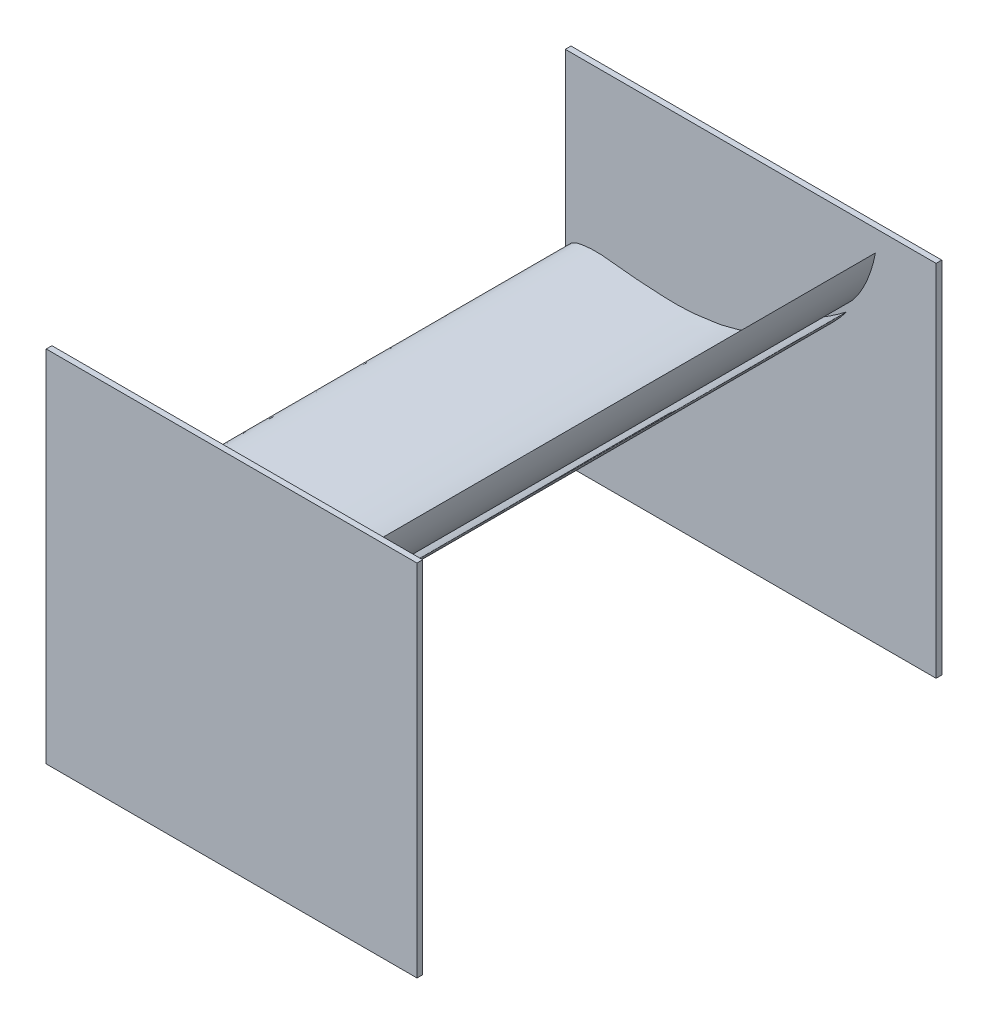
from build123d import *

# Parameters (mm, degrees)
BOSS_EXTRUDE1_DEPTH   = 900
BOSS_EXTRUDE1_2_DEPTH = 900
BOSS_EXTRUDE1_3_DEPTH = 900
SKETCH3_W             = 650
SKETCH3_H             = 630
BOSS_EXTRUDE2_DEPTH   = 10
SKETCH5_W             = 650
SKETCH5_H             = 630
BOSS_EXTRUDE3_DEPTH   = 10


with BuildPart() as part:
    # Sketch2 → Boss-Extrude1 (new body)
    with BuildSketch(Plane.XY):
        with BuildLine():
            add(Edge.make_bspline(
                [(0, 0), (-0.65975565, -5.699703464), (8.017548516, -15.480562025), (19.551157506, -21.724015646), (30.016745353, -25.302215165), (39.859962541, -28.8642232), (50.040399275, -30.662933418), (60.070603806, -32.257702331), (70.013877162, -34.217674322), (80.100972933, -34.55999195), (90.093066457, -35.36519438), (100.111969814, -35.952943269), (110.128217778, -35.507216678), (120.153157744, -35.210003546), (130.150331683, -34.229800116), (140.189993261, -33.410162922), (150.178235204, -31.913406007), (160.170449627, -30.371338734), (170.240789754, -29.163640841), (180.208316099, -27.151030087), (190.263801281, -25.306120223), (200.239152099, -22.872450662), (210.244577583, -20.429111012), (220.232934245, -17.895088966), (230.381125348, -15.705438437), (240.351948949, -12.391144832), (253.551193017, -7.369638816), (266.947574476, -2.806549313), (280.436865809, 1.636643436), (290.361357742, 5.819516769), (300.440735094, 10.032227759), (310.304777653, 14.884053202), (323.821431636, 20.884190166), (337.30228202, 27.249833417), (350.274680503, 34.850235797), (364.037447664, 41.200679435), (378.073354269, 50.431878374), (389.268655411, 56.991671546), (404.933124868, 70.670428585), (388.893146181, 60.897261379), (380.961681237, 56.833339948), (370.316551331, 52.173205743), (360.413556578, 47.749137904), (350.469658047, 43.075442492), (340.496714174, 38.833200032), (330.405194537, 35.260956145), (320.349773519, 31.849438488), (310.358327921, 28.32591748), (300.486931551, 24.662169398), (290.321799777, 22.300639283), (280.290360105, 19.76188557), (270.426731207, 16.765017679), (260.335958512, 15.061341224), (250.276874186, 13.958758108), (240.266180313, 12.578254982), (230.278688892, 11.06786106), (220.28670052, 9.696364143), (210.243264635, 9.240413966), (200.228739037, 9.034505305), (190.217040672, 8.279165066), (180.212460889, 9.162360851), (170.184221628, 8.728504773), (160.186505008, 9.582197967), (150.167787888, 9.989196896), (140.163470123, 10.700746944), (130.145958281, 11.214450998), (120.121382338, 11.840881885), (110.132801048, 12.969737489), (100.114836916, 13.850136605), (90.093770057, 14.715857774), (80.079633724, 15.842660607), (56.917746978, 18.847498868), (32.382831952, 18.963380484), (8.41761673, 12.262874152), (0.546057517, 4.717452477), (0, 0)],
                knots=[0, 0, 0, 0, 0.022023736, 0.035622153, 0.048196888, 0.060584536, 0.072602109, 0.084545422, 0.096478612, 0.108283816, 0.120089627, 0.131879307, 0.143660654, 0.15544949, 0.167268546, 0.17910001, 0.190991158, 0.20289685, 0.214787999, 0.226765538, 0.23876847, 0.250863752, 0.262991876, 0.27512, 0.287234564, 0.299600692, 0.31214973, 0.337081787, 0.34954249, 0.362249466, 0.375072168, 0.388091419, 0.401030286, 0.427260863, 0.440708926, 0.453891579, 0.481343844, 0.495528159, 0.510184265, 0.522427916, 0.535732546, 0.548643086, 0.561553626, 0.574510663, 0.587286643, 0.599816472, 0.612271303, 0.624763182, 0.637218013, 0.649381244, 0.661544475, 0.673750263, 0.685718325, 0.697586388, 0.709471547, 0.721375261, 0.733243324, 0.745039761, 0.756824219, 0.768610895, 0.780397571, 0.792175284, 0.803971722, 0.815766061, 0.82756692, 0.839363385, 0.851169099, 0.863005976, 0.874833225, 0.886659586, 0.898509641, 0.910371212, 0.969295412, 0.981771696, 1, 1, 1, 1], degree=3))
        make_face()
    extrude(amount=BOSS_EXTRUDE1_DEPTH)



with BuildPart() as body_2:
    # Sketch2 → Boss-Extrude1 2 (new body)
    with BuildSketch(Plane.XY):
        with BuildLine():
            add(Edge.make_bspline(
                [(488.73992863, 146.276625829), (488.734390863, 146.282664356), (488.424255517, 146.015046997), (488.06224571, 145.78510435), (487.262468982, 145.126312202), (486.219708703, 144.371292999), (484.873478649, 143.336701677), (483.250678892, 142.116067573), (481.344943871, 140.702556836), (479.183854282, 139.108333078), (476.761259361, 137.364331889), (474.123745832, 135.449437464), (471.236790602, 133.439330858), (468.165688429, 131.291310186), (464.896239769, 129.067635846), (461.457519682, 126.769533617), (457.874048726, 124.410588123), (454.151349507, 122.026984888), (450.329646269, 119.608278587), (446.41836705, 117.19210493), (442.442349173, 114.792641259), (438.43193703, 112.415341988), (434.42114363, 110.058907294), (430.419325782, 107.74839744), (426.469079038, 105.475179612), (422.572434597, 103.270040027), (418.782946314, 101.105445668), (415.103822048, 99.01892845), (411.581105321, 96.980001912), (408.223119368, 95.024650916), (405.070149132, 93.117181313), (402.117764879, 91.312769814), (399.415735867, 89.554324386), (396.965291652, 87.893504979), (394.792388291, 86.318571947), (392.915837215, 84.829964237), (391.349809227, 83.430905822), (390.083467317, 82.150893966), (389.152598068, 80.964624913), (388.566460536, 79.872034746), (388.31048608, 78.86894122), (388.452520239, 77.947544055), (389.013376817, 77.204475769), (389.915554573, 76.684991476), (391.128157446, 76.384212118), (392.650081725, 76.254634507), (394.48507873, 76.313765499), (396.623198675, 76.579439281), (399.045948072, 77.035742523), (401.735792151, 77.720460618), (404.675674285, 78.596752435), (407.839178956, 79.704940552), (411.200777121, 81.026852514), (414.720896472, 82.590974299), (418.395557374, 84.341793332), (422.179917585, 86.309143039), (426.045683707, 88.480043342), (429.970357242, 90.828820323), (433.914957703, 93.364526939), (437.871228384, 96.040204149), (441.793376071, 98.866131635), (445.668479549, 101.797178284), (449.465692449, 104.827226536), (453.167907327, 107.924049831), (456.76145535, 111.053999458), (460.202936902, 114.219487851), (463.519091154, 117.342970547), (466.650128692, 120.455005022), (469.613566921, 123.489837804), (472.370170636, 126.450937081), (474.953957291, 129.265647603), (477.297780382, 131.960513478), (479.456204478, 134.463515761), (481.381106749, 136.784579704), (483.077897662, 138.897364919), (484.557730654, 140.769579134), (485.809879979, 142.38248786), (486.847928071, 143.738913606), (487.625844434, 144.768628828), (488.251100258, 145.595659419), (488.480713959, 145.957078055), (488.74539046, 146.270670107), (488.73992863, 146.276625829)],
                knots=[0, 0, 0, 0, 0.000781199, 0.003073574, 0.006930933, 0.012248071, 0.019030102, 0.027225991, 0.036784991, 0.047610037, 0.059602429, 0.072763906, 0.086896902, 0.102003859, 0.117938515, 0.134556032, 0.151857595, 0.169650659, 0.187837924, 0.206373783, 0.225065344, 0.243814112, 0.262569213, 0.281136751, 0.299513586, 0.317505655, 0.335105223, 0.352118009, 0.368487898, 0.384166869, 0.39895523, 0.412906354, 0.425871787, 0.437810597, 0.448585292, 0.458212857, 0.466668993, 0.473884465, 0.479894259, 0.484778924, 0.488742849, 0.492166792, 0.495627983, 0.499576303, 0.504486665, 0.51057614, 0.517942731, 0.526573967, 0.536524046, 0.547640111, 0.560015283, 0.573490911, 0.58803144, 0.603543533, 0.619911609, 0.637089411, 0.654944026, 0.673346428, 0.692212491, 0.711460838, 0.730910148, 0.750475101, 0.77002178, 0.789460649, 0.808651173, 0.827457923, 0.845819698, 0.863558965, 0.880665567, 0.896944906, 0.912322084, 0.926717772, 0.939992516, 0.952161421, 0.963060032, 0.972661788, 0.980906352, 0.987732879, 0.993080076, 0.996902186, 0.999229514, 1, 1, 1, 1], degree=3))
        make_face()
    extrude(amount=BOSS_EXTRUDE1_2_DEPTH)


with BuildPart() as body_3:
    # Sketch2 → Boss-Extrude1 3 (new body)
    with BuildSketch(Plane.XY):
        with BuildLine():
            add(Edge.make_bspline(
                [(539.23992863, 261.033698992), (539.232300477, 261.036691618), (539.071220974, 260.660007341), (538.84698411, 260.294383835), (538.417825195, 259.351147733), (537.812628412, 258.214713723), (537.057592548, 256.69378277), (536.135798945, 254.884204064), (535.044530514, 252.777041307), (533.803223872, 250.395339111), (532.392762892, 247.764189745), (530.864279848, 244.885087007), (529.153510736, 241.810861132), (527.337878898, 238.531830155), (525.377275818, 235.097694518), (523.297285695, 231.52232813), (521.113971493, 227.82870801), (518.816398825, 224.051771346), (516.445296032, 220.199803879), (513.992600523, 216.310761376), (511.474399485, 212.408292537), (508.915559924, 208.510628132), (506.347212063, 204.63154216), (503.766753677, 200.797660602), (501.216247394, 197.019939369), (498.683993851, 193.326930842), (496.230204047, 189.717423878), (493.841272428, 186.226548478), (491.571959726, 182.847140686), (489.413935946, 179.615187713), (487.419075714, 176.516316995), (485.559160111, 173.598156438), (483.903985045, 170.831274842), (482.431961132, 168.262626571), (481.171565959, 165.893066494), (480.139507952, 163.731252802), (479.34710268, 161.786307292), (478.771655483, 160.079971306), (478.456434932, 158.605231474), (478.409787964, 157.366097849), (478.620462539, 156.352412898), (479.152841571, 155.586972786), (479.983174935, 155.165741091), (481.021950668, 155.095331463), (482.243553358, 155.357787717), (483.667859402, 155.909945444), (485.29054848, 156.769181737), (487.094846627, 157.947148926), (489.071128932, 159.421425429), (491.187042136, 161.2182568), (493.443445817, 163.29704995), (495.798893171, 165.68242869), (498.238430573, 168.346851015), (500.713990203, 171.298526321), (503.24638307, 174.485830725), (505.782214613, 177.91586918), (508.30176656, 181.564550428), (510.796103474, 185.398924032), (513.226226138, 189.409999652), (515.60534525, 193.551959475), (517.887801758, 197.813922504), (520.081812496, 202.149664133), (522.16235077, 206.540137267), (524.128203332, 210.948872483), (525.981871124, 215.33963319), (527.683301699, 219.695521508), (529.290584132, 223.958613558), (530.736576407, 228.13009856), (532.065902489, 232.158595228), (533.241787684, 236.029983649), (534.326712468, 239.693930018), (535.248687863, 243.14478577), (536.088375508, 246.341815089), (536.798178994, 249.272795142), (537.394530655, 251.916437039), (537.901637286, 254.248627252), (538.318092286, 256.247821862), (538.654858961, 257.922523501), (538.901431694, 259.189414684), (539.099884418, 260.207139124), (539.147412047, 260.632726817), (539.247452181, 261.030747402), (539.23992863, 261.033698992)],
                knots=[0, 0, 0, 0, 0.000781199, 0.003073574, 0.006930933, 0.012248071, 0.019030102, 0.027225991, 0.036784991, 0.047610037, 0.059602429, 0.072763906, 0.086896902, 0.102003859, 0.117938515, 0.134556032, 0.151857595, 0.169650659, 0.187837924, 0.206373783, 0.225065344, 0.243814112, 0.262569213, 0.281136751, 0.299513586, 0.317505655, 0.335105223, 0.352118009, 0.368487898, 0.384166869, 0.39895523, 0.412906354, 0.425871787, 0.437810597, 0.448585292, 0.458212857, 0.466668993, 0.473884465, 0.479894259, 0.484778924, 0.488742849, 0.492166792, 0.495627983, 0.499576303, 0.504486665, 0.51057614, 0.517942731, 0.526573967, 0.536524046, 0.547640111, 0.560015283, 0.573490911, 0.58803144, 0.603543533, 0.619911609, 0.637089411, 0.654944026, 0.673346428, 0.692212491, 0.711460838, 0.730910148, 0.750475101, 0.77002178, 0.789460649, 0.808651173, 0.827457923, 0.845819698, 0.863558965, 0.880665567, 0.896944906, 0.912322084, 0.926717772, 0.939992516, 0.952161421, 0.963060032, 0.972661788, 0.980906352, 0.987732879, 0.993080076, 0.996902186, 0.999229514, 1, 1, 1, 1], degree=3))
        make_face()
    extrude(amount=BOSS_EXTRUDE1_3_DEPTH)


with BuildPart() as part_1:
    add(part.part)

    add(body_2.part)  # Boss-Extrude2 merges body 2

    add(body_3.part)  # Boss-Extrude2 merges body 3
    # Sketch3 → Boss-Extrude2 (add)
    with BuildSketch(Plane.XY.offset(900)):
        with Locations((320.596618382, -16.625673365)):
            Rectangle(SKETCH3_W, SKETCH3_H)
    extrude(amount=BOSS_EXTRUDE2_DEPTH)

    # Sketch5 → Boss-Extrude3 (add)
    with BuildSketch(Plane.XY):
        with Locations((320.596618382, -16.625673365)):
            Rectangle(SKETCH5_W, SKETCH5_H)
    extrude(amount=-BOSS_EXTRUDE3_DEPTH)


solid = part_1.part
